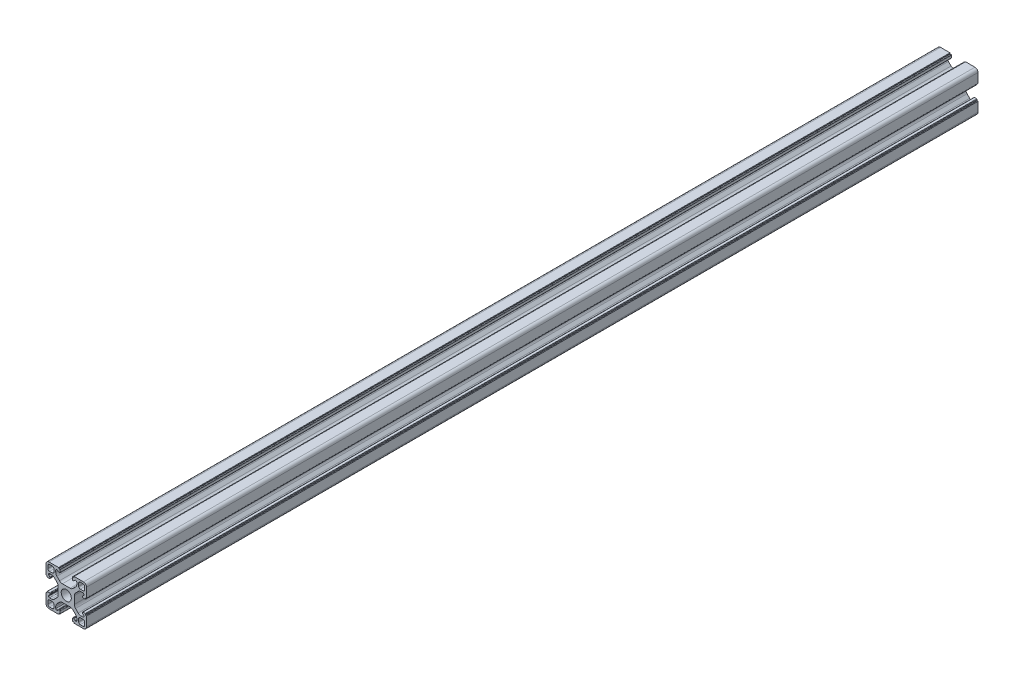
from build123d import *

# Parameters (mm, degrees)
EXTRUDE_1_DEPTH = 440


with BuildPart() as part:
    # Эскиз1 → Бобышка-Вытянуть1 (new body)
    with BuildSketch(Plane.XY):
        with BuildLine():
            Line((-31.105150957, 65.209647948), (-29.206370287, 65.209647948))
            ThreePointArc((-29.206370287, 65.209647948), (-28.441003423, 65.361888883), (-27.792156725, 65.795434385))
            Line((-27.792156725, 65.795434385), (-26.490937394, 67.096653716))
            ThreePointArc((-26.490937394, 67.096653716), (-26.057391892, 67.745500414), (-25.905150957, 68.510867279))
            Line((-25.905150957, 68.510867279), (-25.905150957, 69.409647948))
            ThreePointArc((-25.905150957, 69.409647948), (-26.051597566, 69.763201338), (-26.405150957, 69.909647948))
            Line((-26.405150957, 69.909647948), (-26.508044175, 69.909647948))
            ThreePointArc((-26.508044175, 69.909647948), (-26.699385892, 69.871587714), (-26.861597566, 69.763201338))
            Line((-26.861597566, 69.763201338), (-27.341927652, 69.282871252))
            ThreePointArc((-27.341927652, 69.282871252), (-27.423033489, 69.228678065), (-27.518704347, 69.209647948))
            Line((-27.518704347, 69.209647948), (-27.805150957, 69.209647948))
            ThreePointArc((-27.805150957, 69.209647948), (-27.981927652, 69.282871252), (-28.055150957, 69.459647948))
            Line((-28.055150957, 69.459647948), (-28.055150957, 70.608718768))
            ThreePointArc((-28.055150957, 70.608718768), (-28.011216974, 70.714784785), (-27.905150957, 70.758718768))
            Line((-27.905150957, 70.758718768), (-27.405150957, 70.758718768))
            Line((-27.405150957, 70.758718768), (-27.405150957, 71.059647948))
            ThreePointArc((-27.405150957, 71.059647948), (-27.361216974, 71.165713965), (-27.255150957, 71.209647948))
            Line((-27.255150957, 71.209647948), (-22.605150957, 71.209647948))
            ThreePointArc((-22.605150957, 71.209647948), (-21.544490785, 70.770308119), (-21.105150957, 69.709647948))
            Line((-21.105150957, 69.709647948), (-21.105150957, 65.059647948))
            ThreePointArc((-21.105150957, 65.059647948), (-21.149084939, 64.953581931), (-21.255150957, 64.909647948))
            Line((-21.255150957, 64.909647948), (-21.556080136, 64.909647948))
            Line((-21.556080136, 64.909647948), (-21.556080136, 64.409647948))
            ThreePointArc((-21.556080136, 64.409647948), (-21.600014119, 64.303581931), (-21.706080136, 64.259647948))
            Line((-21.706080136, 64.259647948), (-22.855150957, 64.259647948))
            ThreePointArc((-22.855150957, 64.259647948), (-23.031927652, 64.332871252), (-23.105150957, 64.509647948))
            Line((-23.105150957, 64.509647948), (-23.105150957, 64.796094557))
            ThreePointArc((-23.105150957, 64.796094557), (-23.08612084, 64.891765415), (-23.031927652, 64.972871252))
            Line((-23.031927652, 64.972871252), (-22.551597566, 65.453201338))
            ThreePointArc((-22.551597566, 65.453201338), (-22.44321119, 65.615413013), (-22.405150957, 65.806754729))
            Line((-22.405150957, 65.806754729), (-22.405150957, 65.909647948))
            ThreePointArc((-22.405150957, 65.909647948), (-22.551597566, 66.263201338), (-22.905150957, 66.409647948))
            Line((-22.905150957, 66.409647948), (-23.803931626, 66.409647948))
            ThreePointArc((-23.803931626, 66.409647948), (-24.56929849, 66.257407013), (-25.218145188, 65.82386151))
            Line((-25.218145188, 65.82386151), (-26.519364519, 64.522642179))
            ThreePointArc((-26.519364519, 64.522642179), (-26.952910022, 63.873795482), (-27.105150957, 63.108428617))
            Line((-27.105150957, 63.108428617), (-27.105150957, 61.209647948))
            Line((-27.105150957, 61.209647948), (-27.105150957, 59.310867279))
            ThreePointArc((-27.105150957, 59.310867279), (-26.952910022, 58.545500414), (-26.519364519, 57.896653716))
            Line((-26.519364519, 57.896653716), (-25.218145188, 56.595434385))
            ThreePointArc((-25.218145188, 56.595434385), (-24.56929849, 56.161888883), (-23.803931626, 56.009647948))
            Line((-23.803931626, 56.009647948), (-22.905150957, 56.009647948))
            ThreePointArc((-22.905150957, 56.009647948), (-22.551597566, 56.156094557), (-22.405150957, 56.509647948))
            Line((-22.405150957, 56.509647948), (-22.405150957, 56.612541166))
            ThreePointArc((-22.405150957, 56.612541166), (-22.44321119, 56.803882883), (-22.551597566, 56.966094557))
            Line((-22.551597566, 56.966094557), (-23.031927652, 57.446424643))
            ThreePointArc((-23.031927652, 57.446424643), (-23.08612084, 57.52753048), (-23.105150957, 57.623201338))
            Line((-23.105150957, 57.623201338), (-23.105150957, 57.909647948))
            ThreePointArc((-23.105150957, 57.909647948), (-23.031927652, 58.086424643), (-22.855150957, 58.159647948))
            Line((-22.855150957, 58.159647948), (-21.706080136, 58.159647948))
            ThreePointArc((-21.706080136, 58.159647948), (-21.600014119, 58.115713965), (-21.556080136, 58.009647948))
            Line((-21.556080136, 58.009647948), (-21.556080136, 57.509647948))
            Line((-21.556080136, 57.509647948), (-21.255150957, 57.509647948))
            ThreePointArc((-21.255150957, 57.509647948), (-21.149084939, 57.465713965), (-21.105150957, 57.359647948))
            Line((-21.105150957, 57.359647948), (-21.105150957, 52.709647948))
            ThreePointArc((-21.105150957, 52.709647948), (-21.544490785, 51.648987776), (-22.605150957, 51.209647948))
            Line((-22.605150957, 51.209647948), (-27.255150957, 51.209647948))
            ThreePointArc((-27.255150957, 51.209647948), (-27.361216974, 51.253581931), (-27.405150957, 51.359647948))
            Line((-27.405150957, 51.359647948), (-27.405150957, 51.660577127))
            Line((-27.405150957, 51.660577127), (-27.905150957, 51.660577127))
            ThreePointArc((-27.905150957, 51.660577127), (-28.011216974, 51.70451111), (-28.055150957, 51.810577127))
            Line((-28.055150957, 51.810577127), (-28.055150957, 52.959647948))
            ThreePointArc((-28.055150957, 52.959647948), (-27.981927652, 53.136424643), (-27.805150957, 53.209647948))
            Line((-27.805150957, 53.209647948), (-27.518704347, 53.209647948))
            ThreePointArc((-27.518704347, 53.209647948), (-27.423033489, 53.190617831), (-27.341927652, 53.136424643))
            Line((-27.341927652, 53.136424643), (-26.861597566, 52.656094557))
            ThreePointArc((-26.861597566, 52.656094557), (-26.699385892, 52.547708181), (-26.508044175, 52.509647948))
            Line((-26.508044175, 52.509647948), (-26.405150957, 52.509647948))
            ThreePointArc((-26.405150957, 52.509647948), (-26.051597566, 52.656094557), (-25.905150957, 53.009647948))
            Line((-25.905150957, 53.009647948), (-25.905150957, 53.908428617))
            ThreePointArc((-25.905150957, 53.908428617), (-26.057391892, 54.673795482), (-26.490937394, 55.322642179))
            Line((-26.490937394, 55.322642179), (-27.792156725, 56.62386151))
            ThreePointArc((-27.792156725, 56.62386151), (-28.441003423, 57.057407013), (-29.206370287, 57.209647948))
            Line((-29.206370287, 57.209647948), (-31.105150957, 57.209647948))
            Line((-31.105150957, 57.209647948), (-33.003931626, 57.209647948))
            ThreePointArc((-33.003931626, 57.209647948), (-33.76929849, 57.057407013), (-34.418145188, 56.62386151))
            Line((-34.418145188, 56.62386151), (-35.719364519, 55.322642179))
            ThreePointArc((-35.719364519, 55.322642179), (-36.152910022, 54.673795482), (-36.305150957, 53.908428617))
            Line((-36.305150957, 53.908428617), (-36.305150957, 53.009647948))
            ThreePointArc((-36.305150957, 53.009647948), (-36.158704347, 52.656094557), (-35.805150957, 52.509647948))
            Line((-35.805150957, 52.509647948), (-35.702257738, 52.509647948))
            ThreePointArc((-35.702257738, 52.509647948), (-35.510916022, 52.547708181), (-35.348704347, 52.656094557))
            Line((-35.348704347, 52.656094557), (-34.868374261, 53.136424643))
            ThreePointArc((-34.868374261, 53.136424643), (-34.787268424, 53.190617831), (-34.691597566, 53.209647948))
            Line((-34.691597566, 53.209647948), (-34.405150957, 53.209647948))
            ThreePointArc((-34.405150957, 53.209647948), (-34.228374261, 53.136424643), (-34.155150957, 52.959647948))
            Line((-34.155150957, 52.959647948), (-34.155150957, 51.810577127))
            ThreePointArc((-34.155150957, 51.810577127), (-34.199084939, 51.70451111), (-34.305150957, 51.660577127))
            Line((-34.305150957, 51.660577127), (-34.805150957, 51.660577127))
            Line((-34.805150957, 51.660577127), (-34.805150957, 51.359647948))
            ThreePointArc((-34.805150957, 51.359647948), (-34.849084939, 51.253581931), (-34.955150957, 51.209647948))
            Line((-34.955150957, 51.209647948), (-39.605150957, 51.209647948))
            ThreePointArc((-39.605150957, 51.209647948), (-40.665811128, 51.648987776), (-41.105150957, 52.709647948))
            Line((-41.105150957, 52.709647948), (-41.105150957, 57.359647948))
            ThreePointArc((-41.105150957, 57.359647948), (-41.061216974, 57.465713965), (-40.955150957, 57.509647948))
            Line((-40.955150957, 57.509647948), (-40.654221777, 57.509647948))
            Line((-40.654221777, 57.509647948), (-40.654221777, 58.009647948))
            ThreePointArc((-40.654221777, 58.009647948), (-40.610287794, 58.115713965), (-40.504221777, 58.159647948))
            Line((-40.504221777, 58.159647948), (-39.355150957, 58.159647948))
            ThreePointArc((-39.355150957, 58.159647948), (-39.178374261, 58.086424643), (-39.105150957, 57.909647948))
            Line((-39.105150957, 57.909647948), (-39.105150957, 57.623201338))
            ThreePointArc((-39.105150957, 57.623201338), (-39.124181073, 57.52753048), (-39.178374261, 57.446424643))
            Line((-39.178374261, 57.446424643), (-39.658704347, 56.966094557))
            ThreePointArc((-39.658704347, 56.966094557), (-39.767090723, 56.803882883), (-39.805150957, 56.612541166))
            Line((-39.805150957, 56.612541166), (-39.805150957, 56.509647948))
            ThreePointArc((-39.805150957, 56.509647948), (-39.658704347, 56.156094557), (-39.305150957, 56.009647948))
            Line((-39.305150957, 56.009647948), (-38.406370287, 56.009647948))
            ThreePointArc((-38.406370287, 56.009647948), (-37.641003423, 56.161888883), (-36.992156725, 56.595434385))
            Line((-36.992156725, 56.595434385), (-35.690937394, 57.896653716))
            ThreePointArc((-35.690937394, 57.896653716), (-35.257391892, 58.545500414), (-35.105150957, 59.310867279))
            Line((-35.105150957, 59.310867279), (-35.105150957, 61.209647948))
            Line((-35.105150957, 61.209647948), (-35.105150957, 63.108428617))
            ThreePointArc((-35.105150957, 63.108428617), (-35.257391892, 63.873795482), (-35.690937394, 64.522642179))
            Line((-35.690937394, 64.522642179), (-36.992156725, 65.82386151))
            ThreePointArc((-36.992156725, 65.82386151), (-37.641003423, 66.257407013), (-38.406370287, 66.409647948))
            Line((-38.406370287, 66.409647948), (-39.305150957, 66.409647948))
            ThreePointArc((-39.305150957, 66.409647948), (-39.658704347, 66.263201338), (-39.805150957, 65.909647948))
            Line((-39.805150957, 65.909647948), (-39.805150957, 65.806754729))
            ThreePointArc((-39.805150957, 65.806754729), (-39.767090723, 65.615413013), (-39.658704347, 65.453201338))
            Line((-39.658704347, 65.453201338), (-39.178374261, 64.972871252))
            ThreePointArc((-39.178374261, 64.972871252), (-39.124181073, 64.891765415), (-39.105150957, 64.796094557))
            Line((-39.105150957, 64.796094557), (-39.105150957, 64.509647948))
            ThreePointArc((-39.105150957, 64.509647948), (-39.178374261, 64.332871252), (-39.355150957, 64.259647948))
            Line((-39.355150957, 64.259647948), (-40.504221777, 64.259647948))
            ThreePointArc((-40.504221777, 64.259647948), (-40.610287794, 64.303581931), (-40.654221777, 64.409647948))
            Line((-40.654221777, 64.409647948), (-40.654221777, 64.909647948))
            Line((-40.654221777, 64.909647948), (-40.955150957, 64.909647948))
            ThreePointArc((-40.955150957, 64.909647948), (-41.061216974, 64.953581931), (-41.105150957, 65.059647948))
            Line((-41.105150957, 65.059647948), (-41.105150957, 69.709647948))
            ThreePointArc((-41.105150957, 69.709647948), (-40.665811128, 70.770308119), (-39.605150957, 71.209647948))
            Line((-39.605150957, 71.209647948), (-34.955150957, 71.209647948))
            ThreePointArc((-34.955150957, 71.209647948), (-34.849084939, 71.165713965), (-34.805150957, 71.059647948))
            Line((-34.805150957, 71.059647948), (-34.805150957, 70.758718768))
            Line((-34.805150957, 70.758718768), (-34.305150957, 70.758718768))
            ThreePointArc((-34.305150957, 70.758718768), (-34.199084939, 70.714784785), (-34.155150957, 70.608718768))
            Line((-34.155150957, 70.608718768), (-34.155150957, 69.459647948))
            ThreePointArc((-34.155150957, 69.459647948), (-34.228374261, 69.282871252), (-34.405150957, 69.209647948))
            Line((-34.405150957, 69.209647948), (-34.691597566, 69.209647948))
            ThreePointArc((-34.691597566, 69.209647948), (-34.787268424, 69.228678065), (-34.868374261, 69.282871252))
            Line((-34.868374261, 69.282871252), (-35.348704347, 69.763201338))
            ThreePointArc((-35.348704347, 69.763201338), (-35.510916022, 69.871587714), (-35.702257738, 69.909647948))
            Line((-35.702257738, 69.909647948), (-35.805150957, 69.909647948))
            ThreePointArc((-35.805150957, 69.909647948), (-36.158704347, 69.763201338), (-36.305150957, 69.409647948))
            Line((-36.305150957, 69.409647948), (-36.305150957, 68.510867279))
            ThreePointArc((-36.305150957, 68.510867279), (-36.152910022, 67.745500414), (-35.719364519, 67.096653716))
            Line((-35.719364519, 67.096653716), (-34.418145188, 65.795434385))
            ThreePointArc((-34.418145188, 65.795434385), (-33.76929849, 65.361888883), (-33.003931626, 65.209647948))
            Line((-33.003931626, 65.209647948), (-31.105150957, 65.209647948))
        make_face()
        with BuildLine():
            Line((-24.205150957, 67.309647948), (-22.805150957, 67.309647948))
            ThreePointArc((-22.805150957, 67.309647948), (-22.239465532, 67.543962523), (-22.005150957, 68.109647948))
            Line((-22.005150957, 68.109647948), (-22.005150957, 69.509647948))
            ThreePointArc((-22.005150957, 69.509647948), (-22.239465532, 70.075333373), (-22.805150957, 70.309647948))
            Line((-22.805150957, 70.309647948), (-24.205150957, 70.309647948))
            ThreePointArc((-24.205150957, 70.309647948), (-24.770836381, 70.075333373), (-25.005150957, 69.509647948))
            Line((-25.005150957, 69.509647948), (-25.005150957, 68.109647948))
            ThreePointArc((-25.005150957, 68.109647948), (-24.770836381, 67.543962523), (-24.205150957, 67.309647948))
        make_face(mode=Mode.SUBTRACT)
        with BuildLine():
            Line((-25.005150957, 54.309647948), (-25.005150957, 52.909647948))
            ThreePointArc((-25.005150957, 52.909647948), (-24.770836381, 52.343962523), (-24.205150957, 52.109647948))
            Line((-24.205150957, 52.109647948), (-22.805150957, 52.109647948))
            ThreePointArc((-22.805150957, 52.109647948), (-22.239465532, 52.343962523), (-22.005150957, 52.909647948))
            Line((-22.005150957, 52.909647948), (-22.005150957, 54.309647948))
            ThreePointArc((-22.005150957, 54.309647948), (-22.239465532, 54.875333373), (-22.805150957, 55.109647948))
            Line((-22.805150957, 55.109647948), (-24.205150957, 55.109647948))
            ThreePointArc((-24.205150957, 55.109647948), (-24.770836381, 54.875333373), (-25.005150957, 54.309647948))
        make_face(mode=Mode.SUBTRACT)
        with BuildLine():
            Line((-38.005150957, 55.109647948), (-39.405150957, 55.109647948))
            ThreePointArc((-39.405150957, 55.109647948), (-39.970836381, 54.875333373), (-40.205150957, 54.309647948))
            Line((-40.205150957, 54.309647948), (-40.205150957, 52.909647948))
            ThreePointArc((-40.205150957, 52.909647948), (-39.970836381, 52.343962523), (-39.405150957, 52.109647948))
            Line((-39.405150957, 52.109647948), (-38.005150957, 52.109647948))
            ThreePointArc((-38.005150957, 52.109647948), (-37.439465532, 52.343962523), (-37.205150957, 52.909647948))
            Line((-37.205150957, 52.909647948), (-37.205150957, 54.309647948))
            ThreePointArc((-37.205150957, 54.309647948), (-37.439465532, 54.875333373), (-38.005150957, 55.109647948))
        make_face(mode=Mode.SUBTRACT)
        with BuildLine():
            Line((-37.205150957, 68.109647948), (-37.205150957, 69.509647948))
            ThreePointArc((-37.205150957, 69.509647948), (-37.439465532, 70.075333373), (-38.005150957, 70.309647948))
            Line((-38.005150957, 70.309647948), (-39.405150957, 70.309647948))
            ThreePointArc((-39.405150957, 70.309647948), (-39.970836381, 70.075333373), (-40.205150957, 69.509647948))
            Line((-40.205150957, 69.509647948), (-40.205150957, 68.109647948))
            ThreePointArc((-40.205150957, 68.109647948), (-39.970836381, 67.543962523), (-39.405150957, 67.309647948))
            Line((-39.405150957, 67.309647948), (-38.005150957, 67.309647948))
            ThreePointArc((-38.005150957, 67.309647948), (-37.439465532, 67.543962523), (-37.205150957, 68.109647948))
        make_face(mode=Mode.SUBTRACT)
        with BuildLine():
            ThreePointArc((-28.605150957, 61.209647948), (-29.337384004, 62.977414901), (-31.105150957, 63.709647948))
            ThreePointArc((-31.105150957, 63.709647948), (-32.87291791, 62.977414901), (-33.605150957, 61.209647948))
            ThreePointArc((-33.605150957, 61.209647948), (-32.87291791, 59.441880995), (-31.105150957, 58.709647948))
            ThreePointArc((-31.105150957, 58.709647948), (-29.337384004, 59.441880995), (-28.605150957, 61.209647948))
        make_face(mode=Mode.SUBTRACT)
    extrude(amount=EXTRUDE_1_DEPTH)


solid = part.part
